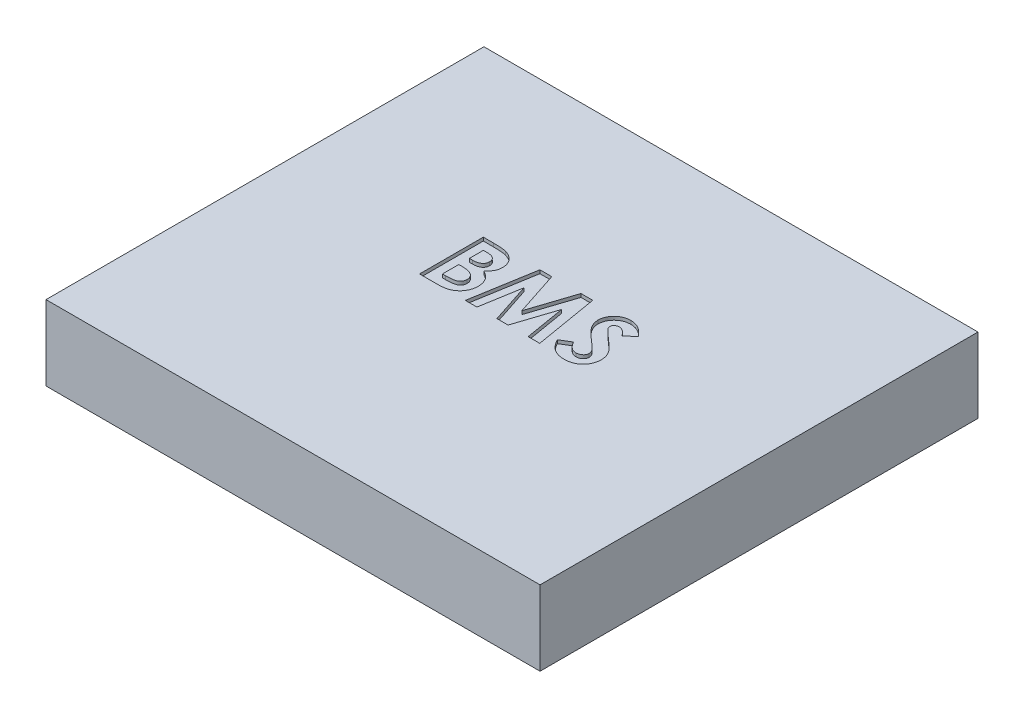
from build123d import *

# Parameters (mm, degrees)
SKETCH1_W           = 116.2
SKETCH1_H           = 103
BOSS_EXTRUDE1_DEPTH = 17.6
CUT_EXTRUDE1_DEPTH  = 0.8


with BuildPart() as part:
    # Sketch1 → Boss-Extrude1 (new body)
    with BuildSketch(Plane(origin=(0, 0, 0), x_dir=(1, 0, 0), z_dir=(0, 1, 0))):
        Rectangle(SKETCH1_W, SKETCH1_H)
    extrude(amount=BOSS_EXTRUDE1_DEPTH)

    # Sketch2 → Cut-Extrude1 (cut)
    # profile 1 of 3: a face of its own
    with BuildSketch(Plane(origin=(0, 17.6, 0), x_dir=(1, 0, 0), z_dir=(0, 1, 0))):
        with BuildLine():
            Line((-19.397420087, -2.347576591), (-19.397420087, 12.652423409))
            Line((-19.397420087, 12.652423409), (-16.993573933, 12.652423409))
            add(Edge.make_bspline(
                [(-16.993573933, 12.652423409), (-16.825289672, 12.652442615), (-16.499662816, 12.652479777), (-16.029868245, 12.635982134), (-15.594173455, 12.614640584), (-15.193964997, 12.590764353), (-14.828561688, 12.549620837), (-14.498519183, 12.506260065), (-14.203178056, 12.453969647), (-14.020584685, 12.407063521), (-13.934679702, 12.384995525)],
                knots=[0, 0, 0, 0, 1.311965854, 2.538629056, 3.664479157, 4.713267157, 5.663616078, 6.530575999, 7.308677837, 8, 8, 8, 8], degree=3))
            add(Edge.make_bspline(
                [(-13.934679702, 12.384995525), (-13.821877738, 12.353868222), (-13.60052407, 12.292786462), (-13.28347498, 12.169429207), (-12.982709692, 12.032308873), (-12.698595432, 11.875880217), (-12.432876776, 11.698254707), (-12.186563544, 11.498022654), (-11.95434337, 11.283221364), (-11.744461861, 11.047864385), (-11.554763558, 10.79916614), (-11.389949744, 10.537191793), (-11.246747664, 10.265947105), (-11.132148491, 9.98201864), (-11.045800167, 9.686713966), (-10.982645363, 9.38129408), (-10.941712498, 9.064792558), (-10.937844879, 8.849466228), (-10.935881625, 8.740163794)],
                knots=[0, 0, 0, 0, 1.099996261, 2.158545794, 3.195537121, 4.207578794, 5.205712374, 6.197378256, 7.190519799, 8.17788031, 9.159561366, 10.129234751, 11.085776129, 12.040971148, 13.00380137, 13.975669004, 14.972423361, 16, 16, 16, 16], degree=3))
            add(Edge.make_bspline(
                [(-10.935881625, 8.740163794), (-10.94101495, 8.599738855), (-10.951119268, 8.323329618), (-11.015666343, 7.917334456), (-11.136702166, 7.533610673), (-11.295074596, 7.165086384), (-11.510411587, 6.813136188), (-11.783847919, 6.477927427), (-12.110954819, 6.149138521), (-12.361863869, 5.952051749), (-12.49237201, 5.849538794)],
                knots=[0, 0, 0, 0, 0.986156485, 1.941127874, 2.875419072, 3.804401753, 4.751181392, 5.761612777, 6.835722519, 8, 8, 8, 8], degree=3))
            add(Edge.make_bspline(
                [(-12.49237201, 5.849538794), (-12.386614473, 5.795550488), (-12.179253203, 5.689694358), (-11.884861118, 5.51569848), (-11.612286184, 5.330631796), (-11.360306255, 5.138217923), (-11.1342069, 4.930300158), (-10.924652097, 4.718859007), (-10.741980192, 4.491779773), (-10.578629469, 4.257155991), (-10.436647675, 4.011590282), (-10.31299719, 3.755497351), (-10.20855406, 3.48800233), (-10.120108916, 3.21046655), (-10.054146504, 2.921935419), (-10.011137609, 2.622305746), (-9.978207311, 2.312599421), (-9.975645643, 2.101635206), (-9.974343164, 1.994370525)],
                knots=[0, 0, 0, 0, 1.164658916, 2.283573913, 3.35186032, 4.395461096, 5.390182219, 6.362969632, 7.312859996, 8.245001507, 9.165155236, 10.092416118, 11.032087915, 11.979892451, 12.947605196, 13.931445124, 14.948243989, 16, 16, 16, 16], degree=3))
            add(Edge.make_bspline(
                [(-9.974343164, 1.994370525), (-9.982795382, 1.789501115), (-9.999475802, 1.385192157), (-10.121434891, 0.791573751), (-10.332873199, 0.228769661), (-10.616791247, -0.300983289), (-10.966632909, -0.78234962), (-11.368850497, -1.204022347), (-11.819394601, -1.56095895), (-12.235075994, -1.801863466), (-12.594607662, -1.963532924), (-12.892401027, -2.063487178), (-13.212224787, -2.156084648), (-13.559937348, -2.221108503), (-13.929235154, -2.280625486), (-14.323718883, -2.317372503), (-14.74265125, -2.342275052), (-15.03039211, -2.345773684), (-15.178670087, -2.347576591)],
                knots=[0, 0, 0, 0, 1.284142165, 2.534249414, 3.780121997, 5.041676246, 6.291546858, 7.49970053, 8.684500223, 9.883330709, 10.50184324, 11.153274765, 11.851151195, 12.587658647, 13.369265475, 14.195992086, 15.070362669, 16, 16, 16, 16], degree=3))
            Line((-15.178670087, -2.347576591), (-19.397420087, -2.347576591))
        make_face()
        with BuildLine():
            Line((-16.705112395, 9.960115717), (-16.705112395, 6.690884948))
            Line((-16.705112395, 6.690884948), (-15.989968164, 6.690884948))
            add(Edge.make_bspline(
                [(-15.989968164, 6.690884948), (-15.892773638, 6.691732521), (-15.705145487, 6.693368709), (-15.434136525, 6.714442248), (-15.182141957, 6.750395016), (-14.950117544, 6.80055817), (-14.735901894, 6.864258062), (-14.540863478, 6.94090275), (-14.365859845, 7.034417601), (-14.1625461, 7.173712098), (-13.947628809, 7.378690187), (-13.758439535, 7.674823506), (-13.647008317, 8.015375695), (-13.634597884, 8.255559469), (-13.628189318, 8.379586871)],
                knots=[0, 0, 0, 0, 1.065314748, 2.056525647, 2.977365736, 3.853934255, 4.656397591, 5.425096493, 6.14721249, 6.826394842, 8.123232004, 9.372140726, 10.643011755, 12, 12, 12, 12], degree=3))
            add(Edge.make_bspline(
                [(-13.628189318, 8.379586871), (-13.633317344, 8.495759139), (-13.643232177, 8.720373552), (-13.755429087, 9.035752191), (-13.92969307, 9.315242212), (-14.135436196, 9.506530274), (-14.329183328, 9.637174381), (-14.495081511, 9.723197963), (-14.677167225, 9.800205393), (-14.878965454, 9.859087151), (-15.099323819, 9.90326995), (-15.337171916, 9.935716924), (-15.592920115, 9.957801715), (-15.769565941, 9.959327838), (-15.860761433, 9.960115717)],
                knots=[0, 0, 0, 0, 1.347982417, 2.606269829, 3.849316587, 5.153353503, 5.842674298, 6.568177932, 7.326619318, 8.142485038, 9.012069166, 9.942760135, 10.937925643, 12, 12, 12, 12], degree=3))
            Line((-15.860761433, 9.960115717), (-16.705112395, 9.960115717))
        make_face(mode=Mode.SUBTRACT)
        with BuildLine():
            Line((-16.705112395, 4.190884948), (-16.705112395, 0.344731101))
            Line((-16.705112395, 0.344731101), (-15.92987201, 0.344731101))
            add(Edge.make_bspline(
                [(-15.92987201, 0.344731101), (-15.776605999, 0.345606704), (-15.481932967, 0.347290161), (-15.059814372, 0.367630313), (-14.676003039, 0.404289855), (-14.331515923, 0.450056339), (-14.025825379, 0.512062767), (-13.759964711, 0.590895994), (-13.530287988, 0.677626274), (-13.33817236, 0.784748468), (-13.181224898, 0.909412137), (-13.039596269, 1.036821402), (-12.92412111, 1.183800026), (-12.832755009, 1.344038624), (-12.75367781, 1.513556754), (-12.705984028, 1.698974038), (-12.669671656, 1.894795152), (-12.667673289, 2.030240382), (-12.666650856, 2.099538794)],
                knots=[0, 0, 0, 0, 1.753078804, 3.370512758, 4.83203934, 6.162291463, 7.344201807, 8.395507345, 9.331626367, 10.147333109, 10.898971645, 11.62040215, 12.321813352, 13.025280112, 13.727906689, 14.453419512, 15.208716525, 16, 16, 16, 16], degree=3))
            add(Edge.make_bspline(
                [(-12.666650856, 2.099538794), (-12.668905614, 2.178782618), (-12.673297276, 2.33312827), (-12.709164034, 2.558720913), (-12.774345648, 2.769326613), (-12.856445071, 2.970330842), (-12.970690781, 3.154536948), (-13.106467903, 3.328319608), (-13.270521328, 3.485794002), (-13.455008974, 3.636484772), (-13.670195549, 3.768422705), (-13.916182011, 3.882902232), (-14.194304693, 3.978511317), (-14.505425108, 4.054635334), (-14.84817933, 4.119240734), (-15.225069087, 4.15781729), (-15.632955511, 4.18650837), (-15.915790595, 4.18939294), (-16.062083548, 4.190884948)],
                knots=[0, 0, 0, 0, 0.845221588, 1.646264278, 2.427170338, 3.19324141, 3.95557735, 4.731569926, 5.540061037, 6.376114724, 7.268642756, 8.224665384, 9.265483498, 10.400594375, 11.639216012, 12.983232105, 14.439614077, 16, 16, 16, 16], degree=3))
            Line((-16.062083548, 4.190884948), (-16.705112395, 4.190884948))
        make_face(mode=Mode.SUBTRACT)
    # profile 2 of 3: a face of its own
    with BuildSketch(Plane(origin=(0, 17.6, 0), x_dir=(1, 0, 0), z_dir=(0, 1, 0))):
        Polygon((-6.095136433, 12.652423409), (-3.300665279, 12.652423409), (0.121810682, 2.189683025), (3.568325105, 12.652423409), (6.33575299, 12.652423409), (8.871810682, -2.347576591), (6.146450105, -2.347576591), (4.544887605, 7.126582063), (1.425897221, -2.347576591), (-1.200304702, -2.347576591), (-4.301266241, 7.126582063), (-5.899823933, -2.347576591), (-8.628189318, -2.347576591), align=None)
    # profile 3 of 3: a face of its own
    with BuildSketch(Plane(origin=(0, 17.6, 0), x_dir=(1, 0, 0), z_dir=(0, 1, 0))):
        with BuildLine():
            Line((19.064118375, 10.648216678), (17.050897221, 8.806269563))
            add(Edge.make_bspline(
                [(17.050897221, 8.806269563), (16.964659459, 8.927916891), (16.799094983, 9.161462797), (16.530732236, 9.47418627), (16.263581284, 9.740962665), (15.995167136, 9.960677513), (15.723110672, 10.131995884), (15.447884142, 10.253291183), (15.171047881, 10.330399756), (14.985056648, 10.340001629), (14.893445298, 10.344731101)],
                knots=[0, 0, 0, 0, 1.299362458, 2.494594718, 3.587462134, 4.587049575, 5.512617175, 6.380583204, 7.202344345, 8, 8, 8, 8], degree=3))
            add(Edge.make_bspline(
                [(14.893445298, 10.344731101), (14.807992858, 10.34173429), (14.643006648, 10.335948236), (14.407806566, 10.278435283), (14.198992583, 10.179176373), (14.016768493, 10.049386998), (13.872420129, 9.893020891), (13.757169154, 9.72903305), (13.692273171, 9.54802756), (13.683731583, 9.423705688), (13.67950299, 9.362158986)],
                knots=[0, 0, 0, 0, 1.185010067, 2.2879431, 3.333075148, 4.379039566, 5.372662701, 6.27520591, 7.14612461, 8, 8, 8, 8], degree=3))
            add(Edge.make_bspline(
                [(13.67950299, 9.362158986), (13.682152835, 9.299724754), (13.687489254, 9.173990886), (13.739031799, 8.989712245), (13.816721132, 8.80965056), (13.890956461, 8.700038444), (13.928902028, 8.644009948)],
                knots=[0, 0, 0, 0, 0.967525499, 1.948461899, 2.951351359, 4, 4, 4, 4], degree=3))
            add(Edge.make_bspline(
                [(13.928902028, 8.644009948), (13.963398654, 8.600459583), (14.04280533, 8.500212396), (14.194217598, 8.341436478), (14.384359607, 8.146922081), (14.620548422, 7.923357985), (14.892979196, 7.66270395), (15.214279448, 7.375206386), (15.575200754, 7.051961827), (15.831735256, 6.826866021), (15.966161644, 6.708913794)],
                knots=[0, 0, 0, 0, 0.473873513, 1.090794244, 1.870441696, 2.795289791, 3.865433203, 5.087734844, 6.473946851, 8, 8, 8, 8], degree=3))
            add(Edge.make_bspline(
                [(15.966161644, 6.708913794), (16.092340146, 6.599712665), (16.331800728, 6.392471609), (16.672505584, 6.098326206), (16.971928409, 5.833690758), (17.23443111, 5.602536879), (17.456034401, 5.402439234), (17.637669905, 5.232441359), (17.78155599, 5.0958528), (17.863346804, 5.013353228), (17.89825299, 4.978144563)],
                knots=[0, 0, 0, 0, 1.543621617, 2.929473131, 4.163658386, 5.240097082, 6.164993805, 6.925417477, 7.541396219, 8, 8, 8, 8], degree=3))
            add(Edge.make_bspline(
                [(17.89825299, 4.978144563), (18.030679781, 4.834830414), (18.285250578, 4.55933029), (18.616102873, 4.13239174), (18.888405014, 3.715612661), (19.099063114, 3.301150678), (19.258160584, 2.88302593), (19.370326407, 2.45098393), (19.437503266, 2.00051011), (19.444961465, 1.69311672), (19.448733759, 1.537639755)],
                knots=[0, 0, 0, 0, 1.206664779, 2.319633467, 3.337109185, 4.282041471, 5.190008762, 6.099243693, 7.03861361, 8, 8, 8, 8], degree=3))
            add(Edge.make_bspline(
                [(19.448733759, 1.537639755), (19.446048737, 1.386146521), (19.440780623, 1.088911156), (19.376256333, 0.653951474), (19.284248483, 0.237676182), (19.141988205, -0.155385059), (18.968602221, -0.531684227), (18.751237849, -0.885359778), (18.495973198, -1.219991055), (18.203400715, -1.529596112), (17.879780806, -1.810541242), (17.532667698, -2.060645233), (17.158667144, -2.267137935), (16.760974545, -2.437169946), (16.339802778, -2.568130874), (15.895653584, -2.664923205), (15.427847608, -2.723016437), (15.10795514, -2.729089395), (14.944527028, -2.732191975)],
                knots=[0, 0, 0, 0, 1.043214005, 2.046824704, 3.02475056, 3.976699089, 4.921714032, 5.875962561, 6.831408892, 7.817874052, 8.806269674, 9.781291748, 10.760897367, 11.74438705, 12.757449933, 13.795994037, 14.874007457, 16, 16, 16, 16], degree=3))
            add(Edge.make_bspline(
                [(14.944527028, -2.732191975), (14.816237352, -2.729916031), (14.562150219, -2.725408356), (14.187664199, -2.688606942), (13.826055613, -2.629213374), (13.477731781, -2.54408465), (13.141123442, -2.43621501), (12.816216774, -2.304456377), (12.505254714, -2.146766542), (12.205884376, -1.966388235), (11.919561069, -1.75694526), (11.642664348, -1.52271961), (11.377944614, -1.26010879), (11.124130471, -0.969733866), (10.882845893, -0.650772563), (10.646192771, -0.30766701), (10.424688681, 0.065950368), (10.287855751, 0.328045981), (10.217964528, 0.461918601)],
                knots=[0, 0, 0, 0, 1.016823716, 2.013894106, 2.979844003, 3.91962641, 4.853723003, 5.779685073, 6.695824784, 7.614987388, 8.547259901, 9.504950863, 10.487499108, 11.500346958, 12.559593716, 13.656357062, 14.802919212, 16, 16, 16, 16], degree=3))
            Line((10.217964528, 0.461918601), (12.58575299, 1.88319264))
            add(Edge.make_bspline(
                [(12.58575299, 1.88319264), (12.673176464, 1.731229724), (12.840774736, 1.439903826), (13.124785675, 1.048470558), (13.415740384, 0.713272759), (13.720365473, 0.44023507), (14.034956817, 0.225706627), (14.361033963, 0.072389718), (14.698826008, -0.022513274), (14.928914604, -0.034103122), (15.043685682, -0.039884283)],
                knots=[0, 0, 0, 0, 1.283663364, 2.460892379, 3.537111102, 4.529833553, 5.449777664, 6.316464042, 7.160231139, 8, 8, 8, 8], degree=3))
            add(Edge.make_bspline(
                [(15.043685682, -0.039884283), (15.160424301, -0.035163073), (15.386914222, -0.026003239), (15.710199602, 0.058603392), (16.00659988, 0.191442009), (16.262806091, 0.380984397), (16.479745356, 0.599745121), (16.639858987, 0.843126429), (16.740443449, 1.10645913), (16.751077665, 1.289387345), (16.756426067, 1.381389755)],
                knots=[0, 0, 0, 0, 1.13588714, 2.203786484, 3.234766741, 4.283437687, 5.291419208, 6.222934724, 7.106237994, 8, 8, 8, 8], degree=3))
            add(Edge.make_bspline(
                [(16.756426067, 1.381389755), (16.751487037, 1.466983027), (16.741453871, 1.640857563), (16.66755266, 1.899381039), (16.552022527, 2.157786945), (16.415342232, 2.369738459), (16.276252918, 2.547199717), (16.143252162, 2.700961869), (15.981292423, 2.870842128), (15.790784362, 3.057054191), (15.574245085, 3.26123733), (15.331492188, 3.48337155), (15.059745891, 3.721500114), (14.867675073, 3.883710939), (14.767243375, 3.968529178)],
                knots=[0, 0, 0, 0, 0.916159276, 1.861089862, 2.860218735, 3.940849679, 4.552606315, 5.27541173, 6.11797699, 7.06649574, 8.129236253, 9.306560635, 10.591630461, 12, 12, 12, 12], degree=3))
            add(Edge.make_bspline(
                [(14.767243375, 3.968529178), (14.576318719, 4.130069746), (14.209876515, 4.440114989), (13.69204719, 4.898042052), (13.225436603, 5.326016853), (12.814074903, 5.729330094), (12.452720706, 6.100533516), (12.14382126, 6.442642173), (11.890769966, 6.758294967), (11.624488043, 7.132164579), (11.371466977, 7.58775039), (11.152784974, 8.135872934), (11.010913321, 8.68392593), (10.995018575, 9.051858526), (10.987195298, 9.232952255)],
                knots=[0, 0, 0, 0, 1.345494975, 2.582412109, 3.71882943, 4.751509156, 5.681369928, 6.505683931, 7.230279997, 7.856715994, 8.973648664, 10.023341002, 11.027102913, 12, 12, 12, 12], degree=3))
            add(Edge.make_bspline(
                [(10.987195298, 9.232952255), (10.990448988, 9.361374208), (10.996859108, 9.614379251), (11.054038368, 9.986386302), (11.139494951, 10.345341849), (11.263602442, 10.689936258), (11.424678981, 11.019737912), (11.620300181, 11.336361328), (11.853503667, 11.636892375), (12.116308254, 11.921131824), (12.405851622, 12.180894333), (12.715265507, 12.410160776), (13.042798598, 12.603802547), (13.386447214, 12.764442458), (13.748340803, 12.887402104), (14.12581331, 12.974562031), (14.519406152, 13.026401975), (14.787119507, 13.033449014), (14.923493375, 13.037038794)],
                knots=[0, 0, 0, 0, 1.010766082, 1.991317756, 2.957454644, 3.913069143, 4.869106762, 5.843196583, 6.838735724, 7.860187025, 8.887984031, 9.89767229, 10.887916223, 11.879572884, 12.879850636, 13.892031539, 14.926195476, 16, 16, 16, 16], degree=3))
            add(Edge.make_bspline(
                [(14.923493375, 13.037038794), (15.100227157, 13.030573495), (15.452299648, 13.017693934), (15.97284898, 12.916979969), (16.481299803, 12.758596651), (16.891019006, 12.567524603), (17.217024927, 12.382433019), (17.466878013, 12.212024004), (17.721116976, 12.016811319), (17.981792097, 11.796179797), (18.244059627, 11.54597245), (18.515377088, 11.272145661), (18.792047446, 10.972332926), (18.971839312, 10.758148098), (19.064118375, 10.648216678)],
                knots=[0, 0, 0, 0, 1.282922637, 2.555718331, 3.837320111, 5.142675274, 5.830281639, 6.55870424, 7.337177975, 8.157850921, 9.037902056, 9.96903443, 10.957596896, 12, 12, 12, 12], degree=3))
        make_face()
    extrude(amount=-CUT_EXTRUDE1_DEPTH, mode=Mode.SUBTRACT)


solid = part.part
